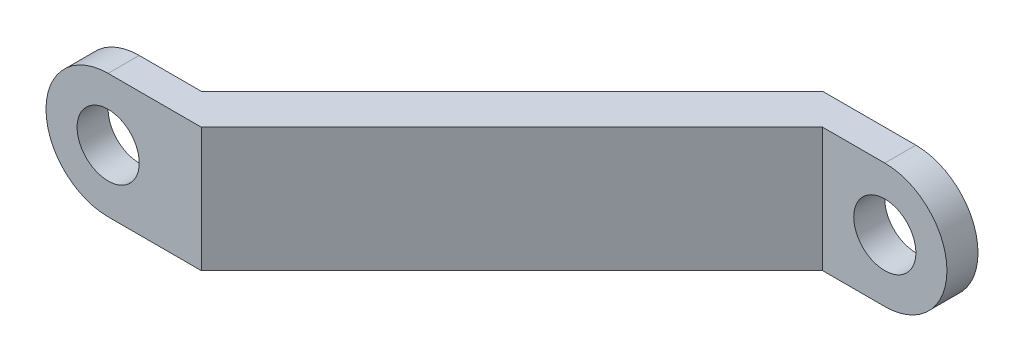
from build123d import *

# Parameters (mm, degrees)
SKETCH_1_R          = 2
EXTRUDE_1_DEPTH     = 2
CUT_EXTRUDE_1_DEPTH = 13.952524728
SKETCH_4_W          = 2.828427125
SKETCH_4_H          = 8
EXTRUDE_2_DEPTH     = 28.28
CUT_EXTRUDE_2_DEPTH = 37.918850015
SKETCH_7_R          = 2
EXTRUDE_3_DEPTH     = 2
EXTRUDE_4_DEPTH     = 8


with BuildPart() as part:
    # 草图1 → 凸台-拉伸1 (new body)
    with BuildSketch(Plane.XY):
        with BuildLine():
            Line((3.9883881, 0), (9.9883881, 0))
            Line((9.9883881, 0), (9.9883881, 8))
            Line((9.9883881, 8), (3.9883881, 8))
            ThreePointArc((3.9883881, 8), (-0.0116119, 4), (3.9883881, 0))
        make_face()
        with Locations((3.9883881, 4)):
            Circle(SKETCH_1_R, mode=Mode.SUBTRACT)
    extrude(amount=EXTRUDE_1_DEPTH)

    # 草图2 → 切除-拉伸1 (cut, through all)
    with BuildSketch(Plane.XZ):
        Polygon((9.9883881, 2), (7.9883881, 0), (9.9883881, 0), align=None)
    extrude(amount=-CUT_EXTRUDE_1_DEPTH, mode=Mode.SUBTRACT)

    # 草图4 → 凸台-拉伸2 (add)
    with BuildSketch(Plane(origin=(3.99419405, 0, -3.99419405), x_dir=(-0.7071067811865488, 0, -0.7071067811865462), z_dir=(0.7071067811865462, 0, -0.7071067811865488))):
        with Locations((-7.062856959, 4)):
            Rectangle(SKETCH_4_W, SKETCH_4_H)
    extrude(amount=EXTRUDE_2_DEPTH)

    # 草图5 → 切除-拉伸2 (cut, through all)
    with BuildSketch(Plane(origin=(0, 8, 0), x_dir=(1, 0, 0), z_dir=(0, 1, 0))):
        Polygon((27.985367872, 19.996979772), (27.985367872, 15.996979772), (29.985367872, 17.996979772), align=None)
    extrude(amount=-CUT_EXTRUDE_2_DEPTH, mode=Mode.SUBTRACT)

    # 草图7 → 凸台-拉伸3 (add)
    with BuildSketch(Plane(origin=(0, 0, -19.998489886), x_dir=(-1, 0, 0), z_dir=(0, 0, -1))):
        with BuildLine():
            Line((-27.985367872, 8), (-33.985367872, 8))
            ThreePointArc((-33.985367872, 8), (-37.985367872, 4), (-33.985367872, 0))
            Line((-33.985367872, 0), (-27.985367872, 0))
            Line((-27.985367872, 0), (-27.985367872, 8))
        make_face()
        with Locations((-33.985367872, 4)):
            Circle(SKETCH_7_R, mode=Mode.SUBTRACT)
    extrude(amount=-EXTRUDE_3_DEPTH)

    # 草图8 → 凸台-拉伸4 (add)
    with BuildSketch(Plane(origin=(0, 8, 0), x_dir=(1, 0, 0), z_dir=(0, 1, 0))):
        Polygon((27.985367872, 15.996979772), (29.986877986, 17.998489886), (27.985367872, 17.998489886), align=None)
    extrude(amount=-EXTRUDE_4_DEPTH)


solid = part.part
